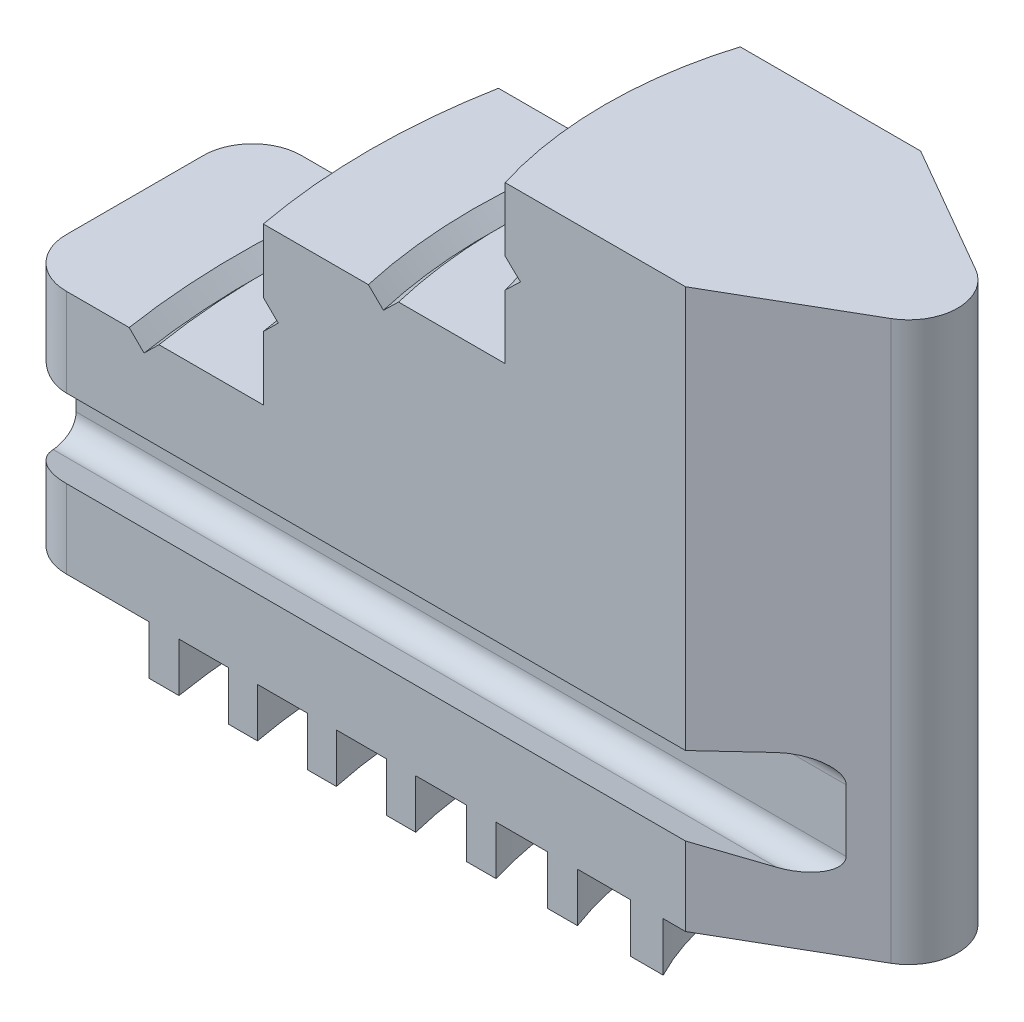
from build123d import *

# Parameters (mm, degrees)
BOSS_EXTRUDE1_DEPTH = 62
SKETCH5_W           = 26
SKETCH5_H           = 5
SKETCH5_W_2         = 5
SKETCH5_W_3         = 14.428632876
CUT_EXTRUDE1_DEPTH  = 106.090437243


with BuildPart() as part:
    # Sketch1 → Boss-Extrude1 (new body)
    with BuildSketch(Plane(origin=(0, 0, 0), x_dir=(1, 0, 0), z_dir=(0, 1, 0))):
        with BuildLine():
            Line((0, -7), (0, 7))
            ThreePointArc((0, 7), (1.464466094, 10.535533906), (5, 12))
            Line((5, 12), (68.215390309, 12))
            Line((68.215390309, 12), (81.5, 4.330127019))
            ThreePointArc((81.5, 4.330127019), (84, 0), (81.5, -4.330127019))
            Line((81.5, -4.330127019), (68.215390309, -12))
            Line((68.215390309, -12), (5, -12))
            ThreePointArc((5, -12), (1.464466094, -10.535533906), (0, -7))
        make_face()
    extrude(amount=BOSS_EXTRUDE1_DEPTH)

    # Sketch2 → Cut-Revolve1 (revolve, cut)
    with BuildSketch(Plane.XY):
        Polygon((48, 62), (48, 55.5), (49.5, 54), (48, 52.5), (48, 46), (37.5, 46), (36, 44.5), (34.5, 46), (24, 46), (24, 39.5), (25.5, 38), (24, 36.5), (24, 30), (13.5, 30), (12, 28.5), (10.5, 30), (0, 30), (-10, 30), (-10, 72), (48, 72), align=None)
    revolve(axis=Axis((89, 71.362230297, 0), (0, -1, 0)), mode=Mode.SUBTRACT)

    # Sketch5 → Cut-Revolve2 (revolve, cut)
    with BuildSketch(Plane.XY):
        with Locations((76, 2.5)):
            Rectangle(SKETCH5_W, SKETCH5_H)
        with Locations((57.5, 2.5)):
            Rectangle(SKETCH5_W_2, SKETCH5_H)
        with Locations((49.603587942, 2.5)):
            Rectangle(SKETCH5_W_2, SKETCH5_H)
        with Locations((41.707175883, 2.5)):
            Rectangle(SKETCH5_W_2, SKETCH5_H)
        with Locations((33.810763825, 2.5)):
            Rectangle(SKETCH5_W_2, SKETCH5_H)
        with Locations((25.914351767, 2.5)):
            Rectangle(SKETCH5_W_2, SKETCH5_H)
        with Locations((18.017939709, 2.5)):
            Rectangle(SKETCH5_W_2, SKETCH5_H)
        with Locations((5.303623271, 2.5)):
            Rectangle(SKETCH5_W_3, SKETCH5_H)
    revolve(axis=Axis((89, 64.780829091, 0), (0, -1, 0)), mode=Mode.SUBTRACT)

    # Sketch6 → Cut-Extrude1 (cut, through all)
    with BuildSketch(Plane(origin=(0, 0, 0), x_dir=(0, 0, -1), z_dir=(1, 0, 0))):
        with BuildLine():
            ThreePointArc((8.601411599, 11.928429193), (6.817380703, 12.222973886), (6, 13.835863095))
            Line((6, 13.835863095), (6, 20.164136905))
            ThreePointArc((6, 20.164136905), (6.817380703, 21.777026114), (8.601411599, 22.071570807))
            Line((8.601411599, 22.071570807), (12, 21))
            Line((12, 21), (12.955765894, 20.698648171))
            Line((12.955765894, 20.698648171), (12.955765894, 13.301351829))
            Line((12.955765894, 13.301351829), (12, 13))
            Line((12, 13), (8.601411599, 11.928429193))
        make_face()
        with BuildLine():
            Line((-6, 13.835863095), (-6, 20.164136905))
            ThreePointArc((-6, 20.164136905), (-6.817380703, 21.777026114), (-8.601411599, 22.071570807))
            Line((-8.601411599, 22.071570807), (-12, 21))
            Line((-12, 21), (-12.955765894, 20.698648171))
            Line((-12.955765894, 20.698648171), (-12.955765894, 13.301351829))
            Line((-12.955765894, 13.301351829), (-12, 13))
            Line((-12, 13), (-8.601411599, 11.928429193))
            ThreePointArc((-8.601411599, 11.928429193), (-6.817380703, 12.222973886), (-6, 13.835863095))
        make_face()
    extrude(amount=CUT_EXTRUDE1_DEPTH, mode=Mode.SUBTRACT)


solid = part.part
